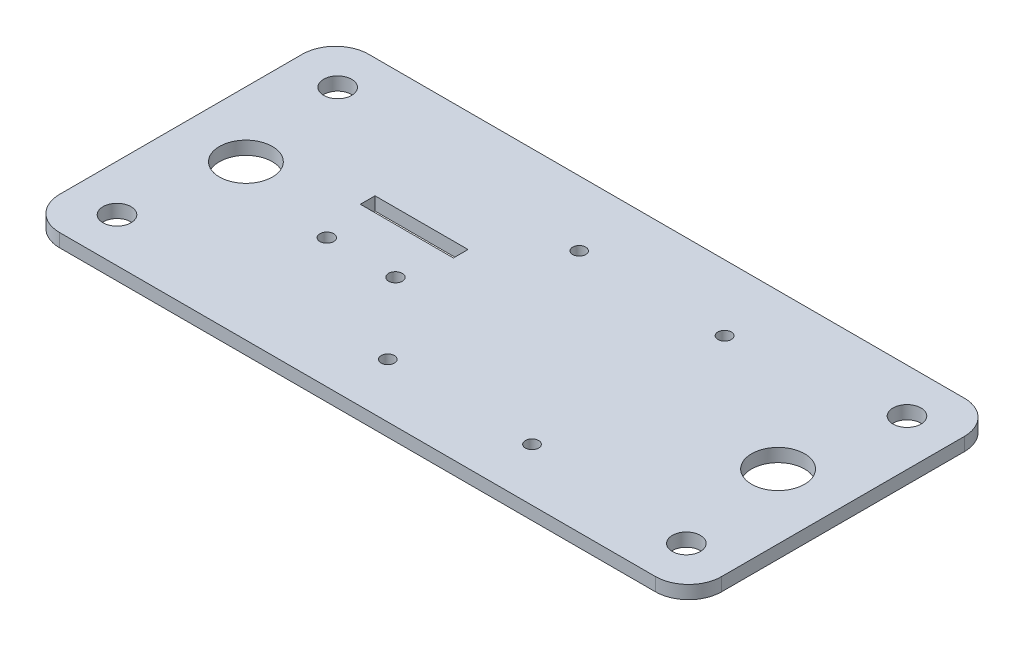
from build123d import *

# Parameters (mm, degrees)
ESBO_O2_W                = 150
ESBO_O2_H                = 70
ESBO_O2_R                = 1.505424276
ESBO_O2_R_2              = 1.49848088
ESBO_O2_R_3              = 1.474413832
ESBO_O2_R_4              = 1.5
ESBO_O2_R_5              = 1.55575
ESBO_O2_W_2              = 21.076348962
ESBO_O2_H_2              = 3.321026243
RESSALTO_EXTRUS_O1_DEPTH = 3
ESBO_O4_R                = 3.175
CORTE_EXTRUS_O1_DEPTH    = 3
FILETE1_R                = 7.5
ESBO_O8_R                = 6
CORTE_EXTRUS_O3_DEPTH    = 10


with BuildPart() as part:
    # Esboço2 → Ressalto-extrusão1 (new body)
    with BuildSketch(Plane(origin=(0, 0, 0), x_dir=(1, 0, 0), z_dir=(0, 1, 0))):
        with Locations((75, 35)):
            Rectangle(ESBO_O2_W, ESBO_O2_H)
        with Locations(Location((103.082572265, 55.082550604, 0), (0, 0, 270))):
            Circle(ESBO_O2_R, mode=Mode.SUBTRACT)
        with Locations(Location((69.55992433, 12.300225249, 0), (0, 0, 270))):
            Circle(ESBO_O2_R_2, mode=Mode.SUBTRACT)
        with Locations(Location((69.954401909, 55.279412058, 0), (0, 0, 270))):
            Circle(ESBO_O2_R_3, mode=Mode.SUBTRACT)
        with Locations(Location((102.570189974, 11.968678193, 0), (0, 0, 270))):
            Circle(ESBO_O2_R_4, mode=Mode.SUBTRACT)
        with Locations(Location((38.765135158, 29.268361159, 0), (0, 0, 270))):
            Circle(ESBO_O2_R_5, mode=Mode.SUBTRACT)
        with Locations(Location((54.322635158, 29.268361159, 0), (0, 0, 270))):
            Circle(ESBO_O2_R_5, mode=Mode.SUBTRACT)
        with Locations((46.559410677, 41.281799613)):
            Rectangle(ESBO_O2_W_2, ESBO_O2_H_2, mode=Mode.SUBTRACT)
    extrude(amount=RESSALTO_EXTRUS_O1_DEPTH)

    # Esboço4 → Corte-extrusão1 (cut)
    with BuildSketch(Plane(origin=(0, 3, 0), x_dir=(1, 0, 0), z_dir=(0, 1, 0))):
        with Locations(Location((10.5, 60, 0), (0, 0, 270))):
            Circle(ESBO_O4_R)
        with Locations(Location((139.5, 60, 0), (0, 0, 270))):
            Circle(ESBO_O4_R)
        with Locations(Location((139.5, 10, 0), (0, 0, 270))):
            Circle(ESBO_O4_R)
        with Locations(Location((10.5, 10, 0), (0, 0, 270))):
            Circle(ESBO_O4_R)
    extrude(amount=-CORTE_EXTRUS_O1_DEPTH, mode=Mode.SUBTRACT)

    # Filete1
    filete1_edges = [part.edges().sort_by_distance(p)[0] for p in [
        (0, 1.5, -70),
        (150, 1.5, -70),
        (150, 1.5, 0),
        (0, 1.5, 0),
    ]]
    fillet(filete1_edges, radius=FILETE1_R)

    # Esboço8 → Corte-extrusão3 (cut)
    with BuildSketch(Plane(origin=(0, 3, 0), x_dir=(1, 0, 0), z_dir=(0, 1, 0))):
        with Locations(Location((14.707477015, 35, 0), (0, 0, 270))):
            Circle(ESBO_O8_R)
        with Locations(Location((135.29252298, 35, 0), (0, 0, 270))):
            Circle(ESBO_O8_R)
    extrude(amount=-CORTE_EXTRUS_O3_DEPTH, mode=Mode.SUBTRACT)


solid = part.part
